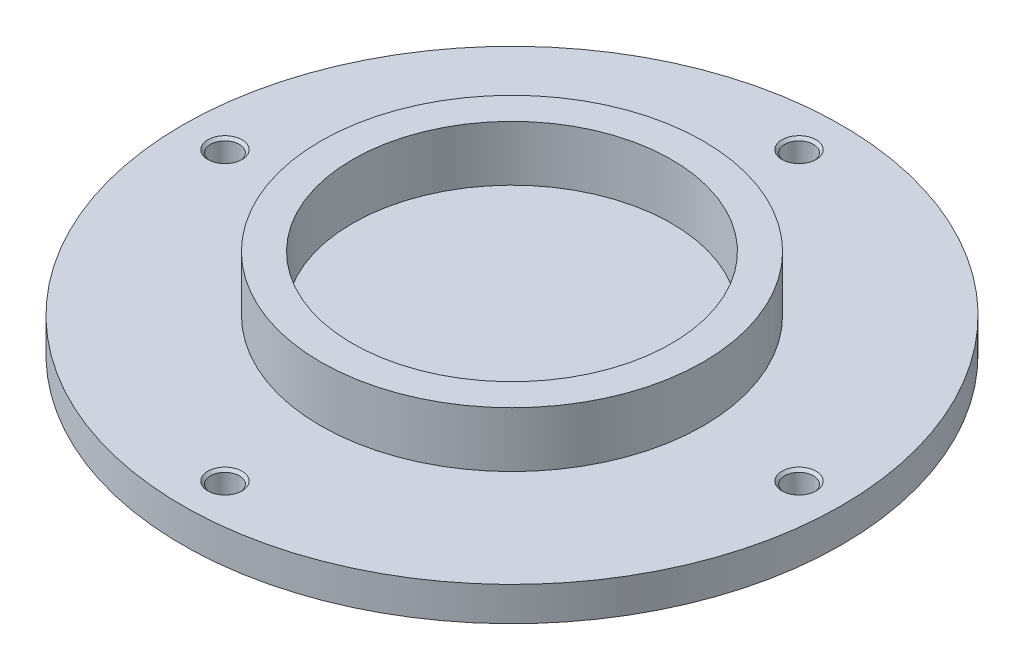
from build123d import *

# Parameters (mm, degrees)
HOLE_WIZARD_M8_1_D           = 6.8
HOLE_WIZARD_M8_1_CSINK_D     = 8.05
HOLE_WIZARD_M8_1_CSINK_ANGLE = 90


with BuildPart() as part:
    # 草图1 → 旋转1 (revolve)
    with BuildSketch(Plane.XY, mode=Mode.PRIVATE) as revolve_1_sk:
        Polygon((0, 0), (77.5, 0), (77.5, 8), (45, 8), (45, 21), (37.5, 21), (37.5, 8), (0, 8), align=None)
    revolve(revolve_1_sk.sketch.rotate(Axis((0, 8, 0), (0, -1, 0)), 180), axis=Axis((0, 8, 0), (0, -1, 0)))

    # M8 螺纹孔1 (through all)
    with Locations(Plane(origin=(0, 8, 0), x_dir=(1, 0, 0), z_dir=(0, 1, 0))):
        with Locations((-67.5, 0), (67.5, 0), (0, -67.5), (0, 67.5)):
            CounterSinkHole(HOLE_WIZARD_M8_1_D / 2, HOLE_WIZARD_M8_1_CSINK_D / 2, counter_sink_angle=HOLE_WIZARD_M8_1_CSINK_ANGLE)


solid = part.part
